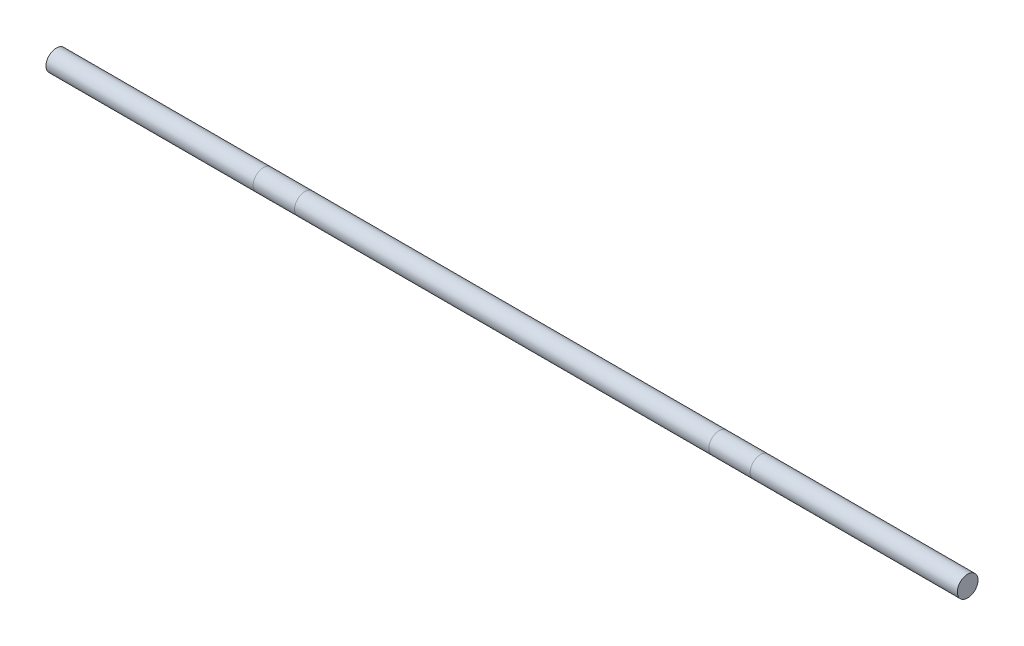
from build123d import *

# Parameters (mm, degrees)
SKETCH_1_R      = 25
EXTRUDE_1_DEPTH = 1100


with BuildPart() as part:
    # 草图1 → 凸台-拉伸1 (new, symmetric)
    with BuildSketch(Plane(origin=(0, 0, 0), x_dir=(0, 0, -1), z_dir=(1, 0, 0))):
        Circle(SKETCH_1_R)
    extrude(amount=EXTRUDE_1_DEPTH, both=True)


solid = part.part
